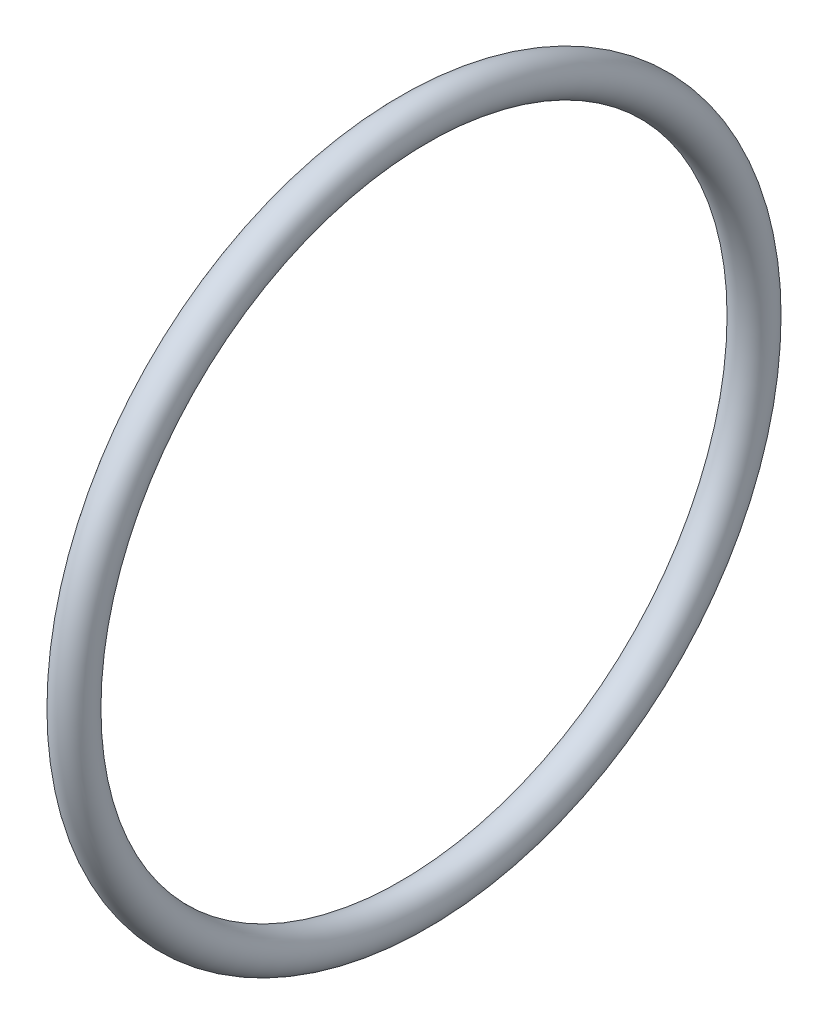
from build123d import *

# Parameters (mm, degrees)
SKETCH2_R = 1.5875


with BuildPart() as part:
    # Sketch2 → Revolve1 (revolve)
    with BuildSketch(Plane.XY, mode=Mode.PRIVATE) as revolve1_sk:
        with Locations((0, 28.2575)):
            Circle(SKETCH2_R)
    revolve(revolve1_sk.sketch.rotate(Axis((0, 0, 0), (1, 0, 0)), 90), axis=Axis((0, 0, 0), (1, 0, 0)))


solid = part.part
